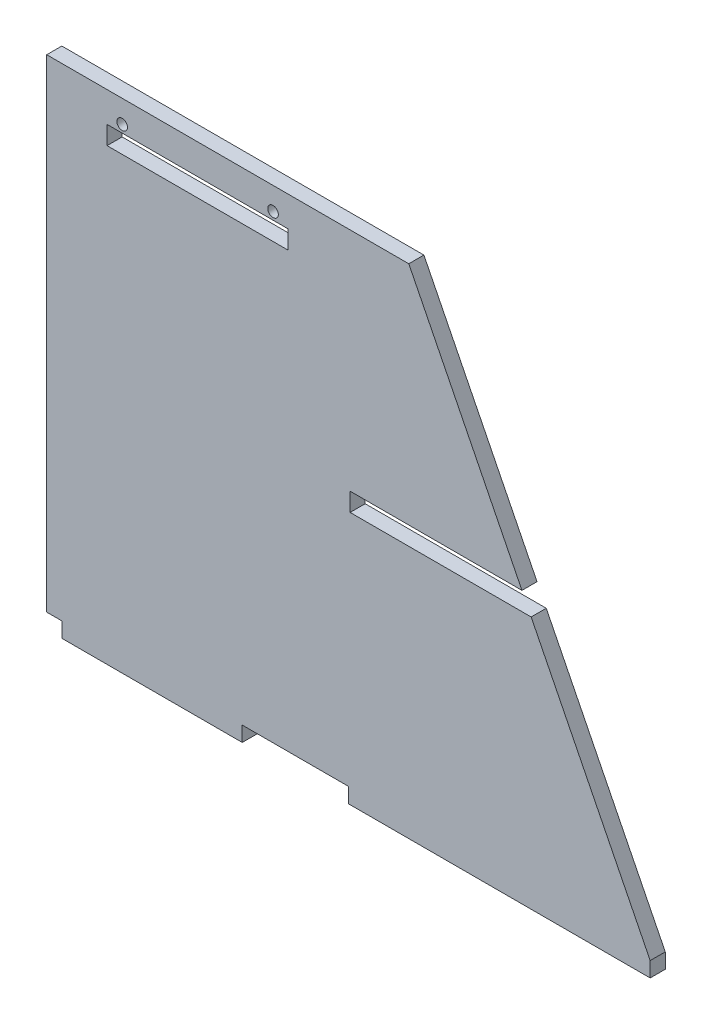
from build123d import *

# Parameters (mm, degrees)
SKETCH1_W           = 100
SKETCH1_H           = 5
SKETCH1_W_2         = 59.8
BOSS_EXTRUDE1_DEPTH = 5
SKETCH2_W           = 60
SKETCH2_H           = 6.1
CUT_EXTRUDE1_DEPTH  = 5
SKETCH3_R           = 1.75
CUT_EXTRUDE2_DEPTH  = 5
SKETCH4_W           = 60
SKETCH4_H           = 6.1
CUT_EXTRUDE3_DEPTH  = 5


with BuildPart() as part:
    # Sketch1 → Boss-Extrude1 (new body)
    with BuildSketch(Plane.XY):
        Polygon((120, 160), (200, 0), (0, 0), (0, 160), align=None)
        with Locations((150, -2.5)):
            Rectangle(SKETCH1_W, SKETCH1_H)
        with Locations((34.9, -2.5)):
            Rectangle(SKETCH1_W_2, SKETCH1_H)
    extrude(amount=BOSS_EXTRUDE1_DEPTH)

    # Sketch2 → Cut-Extrude1 (cut)
    with BuildSketch(Plane.XY.offset(5)):
        with Locations((50, 146.95)):
            Rectangle(SKETCH2_W, SKETCH2_H)
    extrude(amount=-CUT_EXTRUDE1_DEPTH, mode=Mode.SUBTRACT)

    # Sketch3 → Cut-Extrude2 (cut)
    with BuildSketch(Plane.XY.offset(5)):
        with Locations((25, 152.5)):
            Circle(SKETCH3_R)
        with Locations(Location((75, 152.5, 0), (0, 0, 180))):
            Circle(SKETCH3_R)
    extrude(amount=-CUT_EXTRUDE2_DEPTH, mode=Mode.SUBTRACT)

    # Sketch4 → Cut-Extrude3 (cut)
    with BuildSketch(Plane.XY.offset(5)):
        with Locations((130.55, 81.95)):
            Rectangle(SKETCH4_W, SKETCH4_H)
    extrude(amount=-CUT_EXTRUDE3_DEPTH, mode=Mode.SUBTRACT)


solid = part.part
